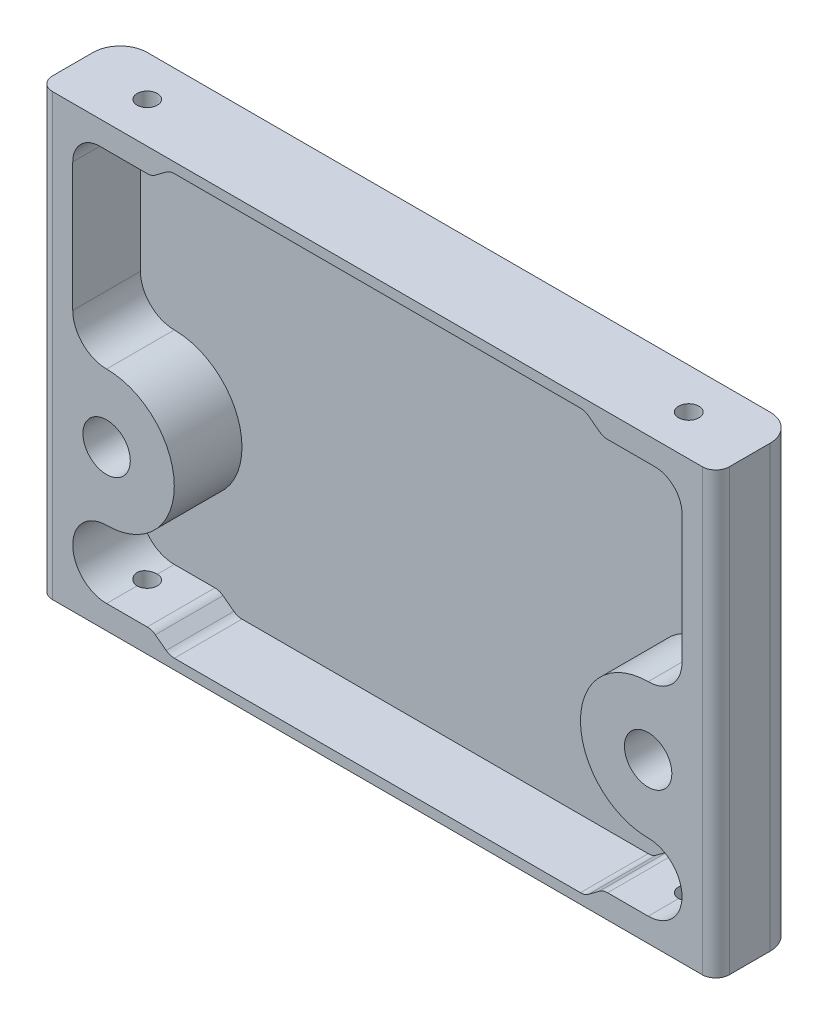
from build123d import *

# Parameters (mm, degrees)
SKETCH_1_W          = 100
SKETCH_1_H          = 65
EXTRUDE_1_DEPTH     = 12
CUT_EXTRUDE_1_DEPTH = 10
SKETCH_2_3_R        = 3.5
CUT_EXTRUDE_2_DEPTH = 61.829680256
SKETCH_3_R          = 1.5
CUT_EXTRUDE_3_DEPTH = 10
CUT_EXTRUDE_START   = -10
SKETCH_4_R          = 1.5
CUT_EXTRUDE_4_DEPTH = 10
FILLET_2_R          = 4
FILLET_3_R          = 2


with BuildPart() as part:
    # 草图1 → 凸台-拉伸1 (new body)
    with BuildSketch(Plane.XY):
        Rectangle(SKETCH_1_W, SKETCH_1_H)
    extrude(amount=EXTRUDE_1_DEPTH)

    # 草图2 → 切除-拉伸1 (cut)
    with BuildSketch(Plane.XY.offset(12)):
        with BuildLine():
            Line((30, 31), (-30, 31))
            ThreePointArc((-30, 31), (-30.632455532, 30.897366596), (-31.2, 30.6))
            Line((-31.2, 30.6), (-32.8, 29.4))
            ThreePointArc((-32.8, 29.4), (-33.367544468, 29.102633404), (-34, 29))
            Line((-34, 29), (-41, 29))
            ThreePointArc((-41, 29), (-43.828427125, 27.828427125), (-45, 25))
            Line((-45, 25), (-45, 6))
            ThreePointArc((-45, 6), (-43.535533906, 2.464466094), (-40, 1))
            ThreePointArc((-40, 1), (-30, -9), (-40, -19))
            ThreePointArc((-40, -19), (-45, -24), (-40, -29))
            Line((-40, -29), (-34, -29))
            ThreePointArc((-34, -29), (-33.367544468, -29.102633404), (-32.8, -29.4))
            Line((-32.8, -29.4), (-31.2, -30.6))
            ThreePointArc((-31.2, -30.6), (-30.632455532, -30.897366596), (-30, -31))
            Line((-30, -31), (30, -31))
            ThreePointArc((30, -31), (30.632455532, -30.897366596), (31.2, -30.6))
            Line((31.2, -30.6), (32.8, -29.4))
            ThreePointArc((32.8, -29.4), (33.367544468, -29.102633404), (34, -29))
            Line((34, -29), (40, -29))
            ThreePointArc((40, -29), (45, -24), (40, -19))
            ThreePointArc((40, -19), (30, -9), (40, 1))
            ThreePointArc((40, 1), (43.535533906, 2.464466094), (45, 6))
            Line((45, 6), (45, 25))
            ThreePointArc((45, 25), (43.828427125, 27.828427125), (41, 29))
            Line((41, 29), (34, 29))
            ThreePointArc((34, 29), (33.367544468, 29.102633404), (32.8, 29.4))
            Line((32.8, 29.4), (31.2, 30.6))
            ThreePointArc((31.2, 30.6), (30.632455532, 30.897366596), (30, 31))
        make_face()
    extrude(amount=-CUT_EXTRUDE_1_DEPTH, mode=Mode.SUBTRACT)

    # 草图2<3> → 切除-拉伸2 (cut, through all)
    with BuildSketch(Plane.XY.offset(12)):
        with Locations((40, -9)):
            Circle(SKETCH_2_3_R)
        with Locations((-40, -9)):
            Circle(SKETCH_2_3_R)
    extrude(amount=-CUT_EXTRUDE_2_DEPTH, mode=Mode.SUBTRACT)

    # 草图3 → 切除-拉伸3 (cut)
    with BuildSketch(Plane(origin=(0, 32.5, 0), x_dir=(1, 0, 0), z_dir=(0, 1, 0))):
        with Locations(Location((40, -6, 0), (0, 0, 270))):
            Circle(SKETCH_3_R)
    cut_extrude_3 = extrude(amount=-CUT_EXTRUDE_3_DEPTH, mode=Mode.SUBTRACT)

    # 草图4 → 切除-拉伸4 (cut)
    with BuildSketch(Plane.XZ.offset(32.5).offset(CUT_EXTRUDE_START)):
        with Locations(Location((40, 6, 0), (0, 0, 90))):
            Circle(SKETCH_4_R)
    cut_extrude_4 = extrude(amount=CUT_EXTRUDE_4_DEPTH, mode=Mode.SUBTRACT)

    # 镜向1: 切除-拉伸3, 切除-拉伸4 across plane
    add(cut_extrude_3.mirror(Plane(origin=(0, 0, 0), x_dir=(0, 0, 1), z_dir=(1, 0, 0))), mode=Mode.SUBTRACT)
    add(cut_extrude_4.mirror(Plane(origin=(0, 0, 0), x_dir=(0, 0, 1), z_dir=(1, 0, 0))), mode=Mode.SUBTRACT)

    # 圆角2
    fillet_2_edges = [part.edges().sort_by_distance(p)[0] for p in [
        (-50, 0, 0),
        (50, 0, 0),
    ]]
    fillet(fillet_2_edges, radius=FILLET_2_R)

    # 圆角3
    fillet_3_edges = [part.edges().sort_by_distance(p)[0] for p in [
        (-50, 0, 12),
        (50, 0, 12),
    ]]
    fillet(fillet_3_edges, radius=FILLET_3_R)


solid = part.part
